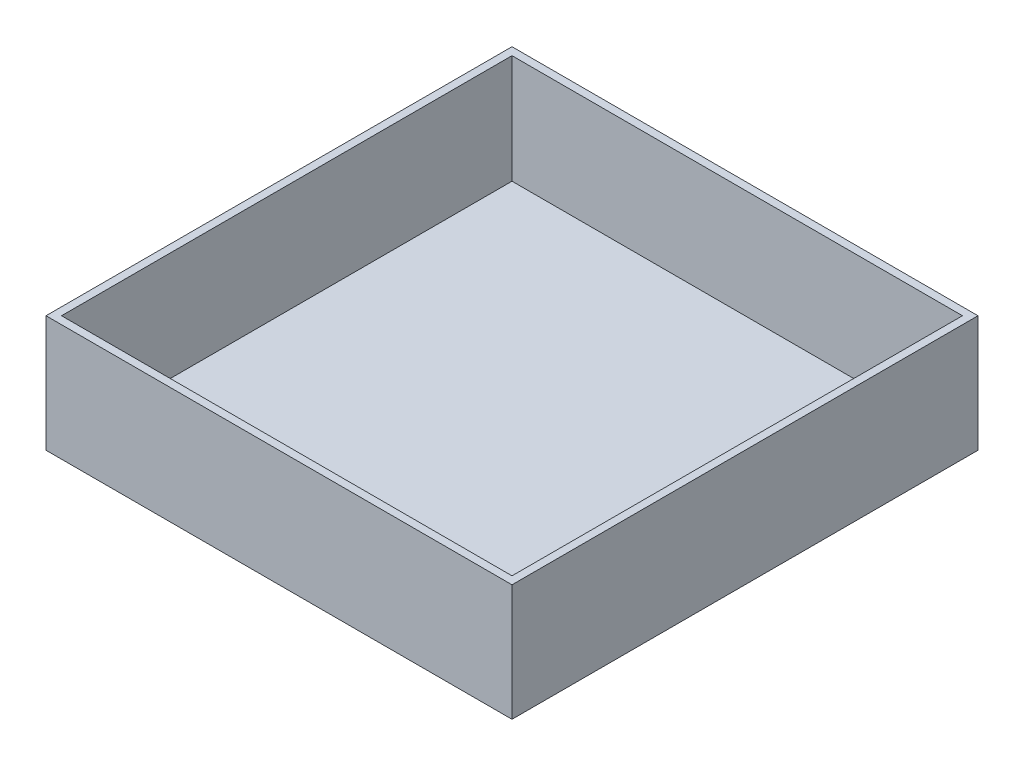
from build123d import *

# Parameters (mm, degrees)
SKETCH1_W           = 60
SKETCH1_H           = 60
BOSS_EXTRUDE1_DEPTH = 1
SKETCH2_W           = 60
SKETCH2_H           = 60
SKETCH2_W_2         = 58
SKETCH2_H_2         = 58
BOSS_EXTRUDE2_DEPTH = 14


with BuildPart() as part:
    # Sketch1 → Boss-Extrude1 (new body)
    with BuildSketch(Plane(origin=(0, 0, 0), x_dir=(1, 0, 0), z_dir=(0, 1, 0))):
        with Locations((30, 30)):
            Rectangle(SKETCH1_W, SKETCH1_H)
    extrude(amount=BOSS_EXTRUDE1_DEPTH)

    # Sketch2 → Boss-Extrude2 (add)
    with BuildSketch(Plane(origin=(0, 1, 0), x_dir=(1, 0, 0), z_dir=(0, 1, 0))):
        with Locations((30, 30)):
            Rectangle(SKETCH2_W, SKETCH2_H)
        with Locations((30, 30)):
            Rectangle(SKETCH2_W_2, SKETCH2_H_2, mode=Mode.SUBTRACT)
    extrude(amount=BOSS_EXTRUDE2_DEPTH)


solid = part.part
